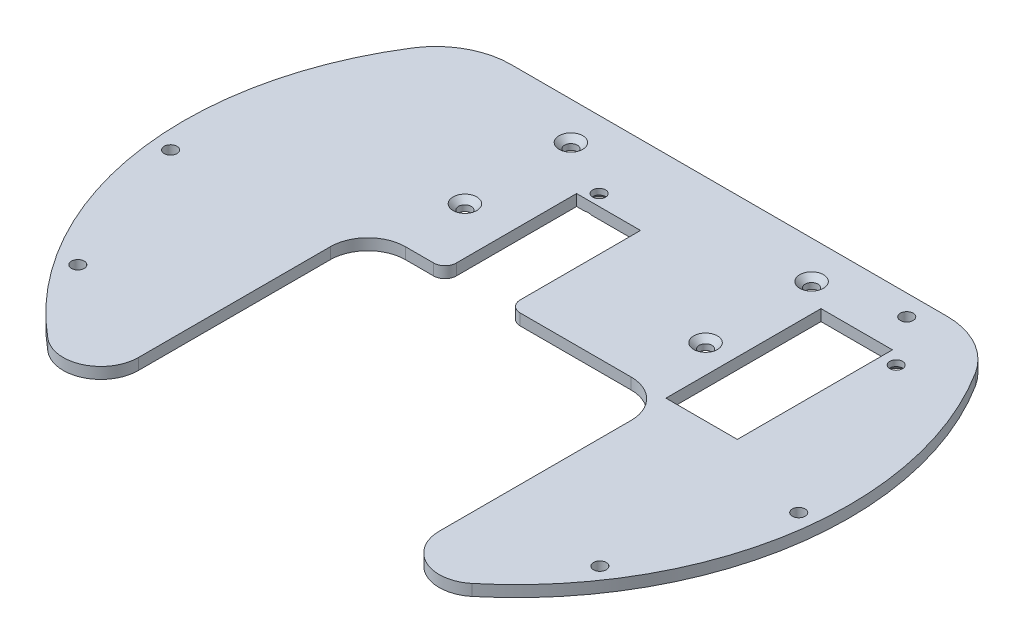
from build123d import *

# Parameters (mm, degrees)
BOSS_EXTRUDE1_DEPTH                            = 3
F_3_4_3_4_DIAMETER_HOLE2_D                     = 3.4
CSK_FOR_M3_FLAT_HEAD_MACHINE_SCREW1_AT_2_COUNT = 2
CSK_FOR_M3_FLAT_HEAD_MACHINE_SCREW1_AT_2_PITCH = 28.2
CSK_FOR_M3_FLAT_HEAD_MACHINE_SCREW1_AT_3_COUNT = 2
CSK_FOR_M3_FLAT_HEAD_MACHINE_SCREW1_AT_3_PITCH = 64
CSK_FOR_M3_FLAT_HEAD_MACHINE_SCREW1_AT_4_COUNT = 2
CSK_FOR_M3_FLAT_HEAD_MACHINE_SCREW1_AT_4_PITCH = 69.937400581
CUT_EXTRUDE1_DEPTH                             = 126.193849689
CUT_EXTRUDE1_DEPTH_BACK                        = 10
FILLET1_R                                      = 10
BOSS_EXTRUDE3_START                            = 1.75
SKETCH9_R                                      = 5.5
SKETCH9_R_2                                    = 1.7
BOSS_EXTRUDE3_DEPTH                            = 1.75
SKETCH12_W                                     = 17
SKETCH12_H                                     = 35
SKETCH12_W_2                                   = 19
SKETCH12_H_2                                   = 41.25
SKETCH12_R                                     = 1.7
CUT_EXTRUDE2_DEPTH                             = 114.258081537
CSK_FOR_M3_FLAT_HEAD_MACHINE_SCREW2_AT_2_COUNT = 2
CSK_FOR_M3_FLAT_HEAD_MACHINE_SCREW2_AT_2_PITCH = 79
FILLET2_R                                      = 20
FILLET3_R                                      = 3


with BuildPart() as part:
    # Sketch1 → Boss-Extrude1 (new body)
    with BuildSketch(Plane(origin=(0, 0, 0), x_dir=(1, 0, 0), z_dir=(0, 1, 0))):
        with BuildLine():
            Line((-68.117545464, 56.5), (68.117545464, 56.5))
            ThreePointArc((68.117545464, 56.5), (0, -88.5), (-68.117545464, 56.5))
        make_face()
    extrude(amount=BOSS_EXTRUDE1_DEPTH)

    # Ø3.4 (3.4) Diameter Hole2 (through all)
    with Locations(Plane(origin=(0, 3, 0), x_dir=(1, 0, 0), z_dir=(0, 1, 0))):
        with Locations((69.405322414, -47.216282822), (-83.517603132, -8.443110213), (-69.405322414, -47.216282822), (52.8, 51), (83.517603132, -8.443110213)):
            Hole(F_3_4_3_4_DIAMETER_HOLE2_D / 2)

    # Sketch6 → CSK for M3 Flat Head Machine Screw1 (revolve, cut)
    with BuildSketch(Plane(origin=(32, 3, -46.5), x_dir=(0, 0, 1), z_dir=(1, 0, 0))):
        Polygon((0, 0), (0, 3), (1.7, 3), (1.7, 1.45), (3.15, 0), align=None)
    csk_for_m3_flat_head_machine_screw1 = revolve(axis=Axis((32, 9.35, -46.5), (0, -1, 0)), mode=Mode.SUBTRACT)

    # CSK for M3 Flat Head Machine Screw1 at 2: CSK for M3 Flat Head Machine Screw1 ×2
    with Locations(*[(0, 0, i * CSK_FOR_M3_FLAT_HEAD_MACHINE_SCREW1_AT_2_PITCH) for i in range(1, CSK_FOR_M3_FLAT_HEAD_MACHINE_SCREW1_AT_2_COUNT)]):
        add(csk_for_m3_flat_head_machine_screw1, mode=Mode.SUBTRACT)

    # CSK for M3 Flat Head Machine Screw1 at 3: CSK for M3 Flat Head Machine Screw1 ×2
    with Locations(*[(-i * CSK_FOR_M3_FLAT_HEAD_MACHINE_SCREW1_AT_3_PITCH, 0, 0) for i in range(1, CSK_FOR_M3_FLAT_HEAD_MACHINE_SCREW1_AT_3_COUNT)]):
        add(csk_for_m3_flat_head_machine_screw1, mode=Mode.SUBTRACT)

    # CSK for M3 Flat Head Machine Screw1 at 4: CSK for M3 Flat Head Machine Screw1 ×2
    with Locations(*[Vector(-0.9151040711908488, 0, 0.4032177313684679) * (i * CSK_FOR_M3_FLAT_HEAD_MACHINE_SCREW1_AT_4_PITCH) for i in range(1, CSK_FOR_M3_FLAT_HEAD_MACHINE_SCREW1_AT_4_COUNT)]):
        add(csk_for_m3_flat_head_machine_screw1, mode=Mode.SUBTRACT)

    # Sketch7 → Cut-Extrude1 (cut, two sides: drawn at the far end of the back side and taken through both)
    with BuildSketch(Plane(origin=(0, 3, 0), x_dir=(1, 0, 0), z_dir=(0, 1, 0)).offset(-CUT_EXTRUDE1_DEPTH_BACK)):
        with BuildLine():
            Line((40, -78.944600829), (40, 0.5))
            Line((40, 0.5), (-40, 0.5))
            Line((-40, 0.5), (-40, -78.944600829))
            ThreePointArc((-40, -78.944600829), (0, -88.5), (40, -78.944600829))
        make_face()
    extrude(amount=CUT_EXTRUDE1_DEPTH + CUT_EXTRUDE1_DEPTH_BACK, mode=Mode.SUBTRACT)

    # Fillet1
    fillet1_edges = [part.edges().sort_by_distance(p)[0] for p in [
        (40, 1.5, 78.944600829),
        (-40, 1.5, 78.944600829),
        (40, 1.5, -0.5),
        (-40, 1.5, -0.5),
    ]]
    fillet(fillet1_edges, radius=FILLET1_R)

    # Sketch9 → Boss-Extrude3 (add)
    with BuildSketch(Plane.XZ.offset(BOSS_EXTRUDE3_START)):
        with Locations(Location((52.8, -51, 0), (0, 0, 270))):
            Circle(SKETCH9_R)
        with Locations(Location((52.8, -51, 0), (0, 0, 90))):
            Circle(SKETCH9_R_2, mode=Mode.SUBTRACT)
    extrude(amount=-BOSS_EXTRUDE3_DEPTH)

    # Sketch12 → Cut-Extrude2 (cut, through all)
    with BuildSketch(Plane(origin=(0, 3, 0), x_dir=(1, 0, 0), z_dir=(0, 1, 0))):
        with Locations((-11, 18)):
            Rectangle(SKETCH12_W, SKETCH12_H)
        with Locations((49, 20.875)):
            Rectangle(SKETCH12_W_2, SKETCH12_H_2)
        with Locations(Location((-16.5, 38.5, 0), (0, 0, 270))):
            Circle(SKETCH12_R)
        with Locations(Location((62.5, 38.5, 0), (0, 0, 270))):
            Circle(SKETCH12_R)
    extrude(amount=-CUT_EXTRUDE2_DEPTH, mode=Mode.SUBTRACT)

    # Sketch13 → CSK for M3 Flat Head Machine Screw2 (revolve, cut)
    with BuildSketch(Plane(origin=(62.5, 0, -38.5), x_dir=(0, 0, -1), z_dir=(1, 0, 0))):
        Polygon((0, 0), (0, 3), (1.7, 3), (1.7, 1.45), (3.15, 0), align=None)
    csk_for_m3_flat_head_machine_screw2 = revolve(axis=Axis((62.5, -6.35, -38.5), (0, 1, 0)), mode=Mode.SUBTRACT)

    # CSK for M3 Flat Head Machine Screw2 at 2: CSK for M3 Flat Head Machine Screw2 ×2
    with Locations(*[(-i * CSK_FOR_M3_FLAT_HEAD_MACHINE_SCREW2_AT_2_PITCH, 0, 0) for i in range(1, CSK_FOR_M3_FLAT_HEAD_MACHINE_SCREW2_AT_2_COUNT)]):
        add(csk_for_m3_flat_head_machine_screw2, mode=Mode.SUBTRACT)

    # Fillet2
    fillet2_edges = [part.edges().sort_by_distance(p)[0] for p in [
        (-68.117545464, 1.5, -56.5),
        (68.117545464, 1.5, -56.5),
    ]]
    fillet(fillet2_edges, radius=FILLET2_R)

    # Fillet3
    fillet3_edges = [part.edges().sort_by_distance(p)[0] for p in [
        (-19.5, 1.5, -0.5),
        (-2.5, 1.5, -0.5),
    ]]
    fillet(fillet3_edges, radius=FILLET3_R)


solid = part.part
